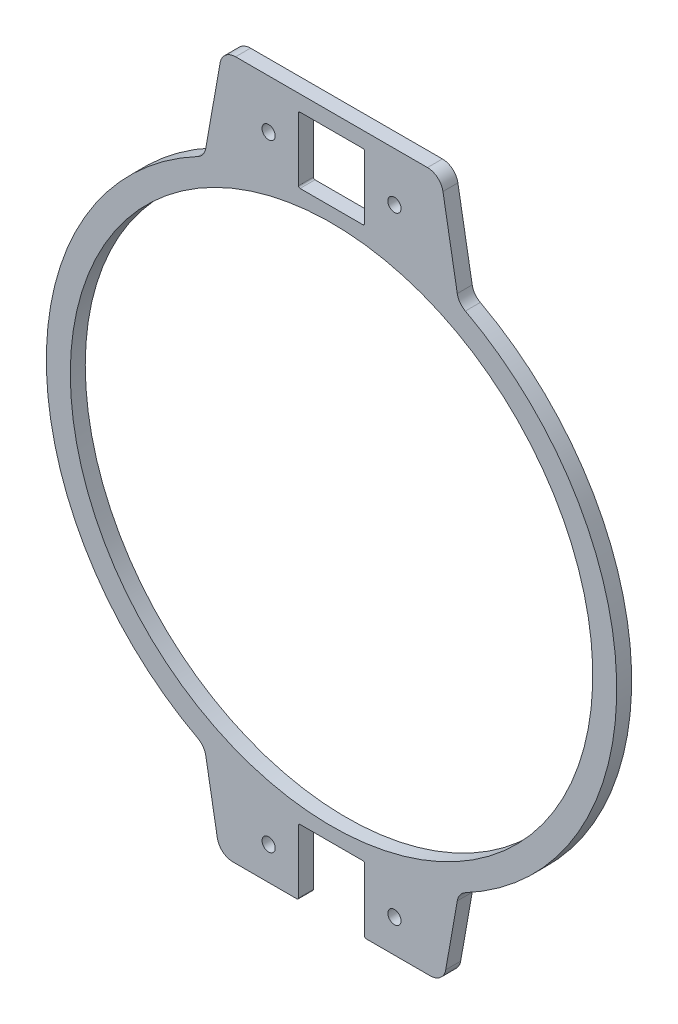
from build123d import *

# Parameters (mm, degrees)
SKETCH2_R           = 83.05
SKETCH2_R_2         = 2.75
BOSS_EXTRUDE1_DEPTH = 4.7498
SKETCH3_R           = 2.75
SKETCH3_R_2         = 2.1
BOSS_EXTRUDE2_DEPTH = 4.7498


with BuildPart() as part:
    # Sketch2 → Boss-Extrude1 (new body)
    with BuildSketch(Plane(origin=(0, 0, 109.855), x_dir=(-1, 0, 0), z_dir=(0, 0, -1))):
        with BuildLine():
            Line((-31.381634904, -108.55), (-11, -108.55))
            ThreePointArc((-11, -108.55), (-10.646446609, -108.403553391), (-10.5, -108.05))
            Line((-10.5, -108.05), (-10.5, -88.05))
            ThreePointArc((-10.5, -88.05), (-10.353553391, -87.696446609), (-10, -87.55))
            Line((-10, -87.55), (10, -87.55))
            ThreePointArc((10, -87.55), (10.353553391, -87.696446609), (10.5, -88.05))
            Line((10.5, -88.05), (10.5, -108.05))
            ThreePointArc((10.5, -108.05), (10.646446609, -108.403553391), (11, -108.55))
            Line((11, -108.55), (31.381634904, -108.55))
            ThreePointArc((31.381634904, -108.55), (34.595572952, -107.380222216), (36.305673669, -104.418240888))
            Line((36.305673669, -104.418240888), (39.974409604, -83.611805478))
            ThreePointArc((39.974409604, -83.611805478), (40.853639928, -81.540739531), (42.55192133, -80.064866772))
            ThreePointArc((42.55192133, -80.064866772), (90.67, 0), (42.55192133, 80.064866772))
            ThreePointArc((42.55192133, 80.064866772), (40.853639928, 81.540739531), (39.974409604, 83.611805478))
            Line((39.974409604, 83.611805478), (35.424038765, 109.418240888))
            ThreePointArc((35.424038765, 109.418240888), (33.713938048, 112.380222216), (30.5, 113.55))
            Line((30.5, 113.55), (-30.5, 113.55))
            ThreePointArc((-30.5, 113.55), (-33.713938048, 112.380222216), (-35.424038765, 109.418240888))
            Line((-35.424038765, 109.418240888), (-39.974409604, 83.611805478))
            ThreePointArc((-39.974409604, 83.611805478), (-40.853639928, 81.540739531), (-42.55192133, 80.064866772))
            ThreePointArc((-42.55192133, 80.064866772), (-90.67, 0), (-42.55192133, -80.064866772))
            ThreePointArc((-42.55192133, -80.064866772), (-40.853639928, -81.540739531), (-39.974409604, -83.611805478))
            Line((-39.974409604, -83.611805478), (-36.305673669, -104.418240888))
            ThreePointArc((-36.305673669, -104.418240888), (-34.595572952, -107.380222216), (-31.381634904, -108.55))
        make_face()
        Circle(SKETCH2_R, mode=Mode.SUBTRACT)
        with Locations((20, 98.05)):
            Circle(SKETCH2_R_2, mode=Mode.SUBTRACT)
        with Locations((-20, 98.05)):
            Circle(SKETCH2_R_2, mode=Mode.SUBTRACT)
        with Locations((20, -98.05)):
            Circle(SKETCH2_R_2, mode=Mode.SUBTRACT)
        with Locations((-20, -98.05)):
            Circle(SKETCH2_R_2, mode=Mode.SUBTRACT)
        with BuildLine():
            Line((10, 87.55), (-10, 87.55))
            ThreePointArc((-10, 87.55), (-10.353553391, 87.696446609), (-10.5, 88.05))
            Line((-10.5, 88.05), (-10.5, 108.05))
            ThreePointArc((-10.5, 108.05), (-10.353553391, 108.403553391), (-10, 108.55))
            Line((-10, 108.55), (10, 108.55))
            ThreePointArc((10, 108.55), (10.353553391, 108.403553391), (10.5, 108.05))
            Line((10.5, 108.05), (10.5, 88.05))
            ThreePointArc((10.5, 88.05), (10.353553391, 87.696446609), (10, 87.55))
        make_face(mode=Mode.SUBTRACT)
    extrude(amount=BOSS_EXTRUDE1_DEPTH)

    # Sketch3 → Boss-Extrude2 (add)
    # profile 1 of 4: a face of its own
    with BuildSketch(Plane.XY.offset(109.855)):
        with Locations((-20, 98.05)):
            Circle(SKETCH3_R)
        with Locations((-20, 98.05)):
            Circle(SKETCH3_R_2, mode=Mode.SUBTRACT)
    # profile 2 of 4: a face of its own
    with BuildSketch(Plane.XY.offset(109.855)):
        with Locations((20, 98.05)):
            Circle(SKETCH3_R)
        with Locations((20, 98.05)):
            Circle(SKETCH3_R_2, mode=Mode.SUBTRACT)
    # profile 3 of 4: a face of its own
    with BuildSketch(Plane.XY.offset(109.855)):
        with Locations((20, -98.05)):
            Circle(SKETCH3_R)
        with Locations((20, -98.05)):
            Circle(SKETCH3_R_2, mode=Mode.SUBTRACT)
    # profile 4 of 4: a face of its own
    with BuildSketch(Plane.XY.offset(109.855)):
        with Locations((-20, -98.05)):
            Circle(SKETCH3_R)
        with Locations((-20, -98.05)):
            Circle(SKETCH3_R_2, mode=Mode.SUBTRACT)
    extrude(amount=-BOSS_EXTRUDE2_DEPTH)


solid = part.part
